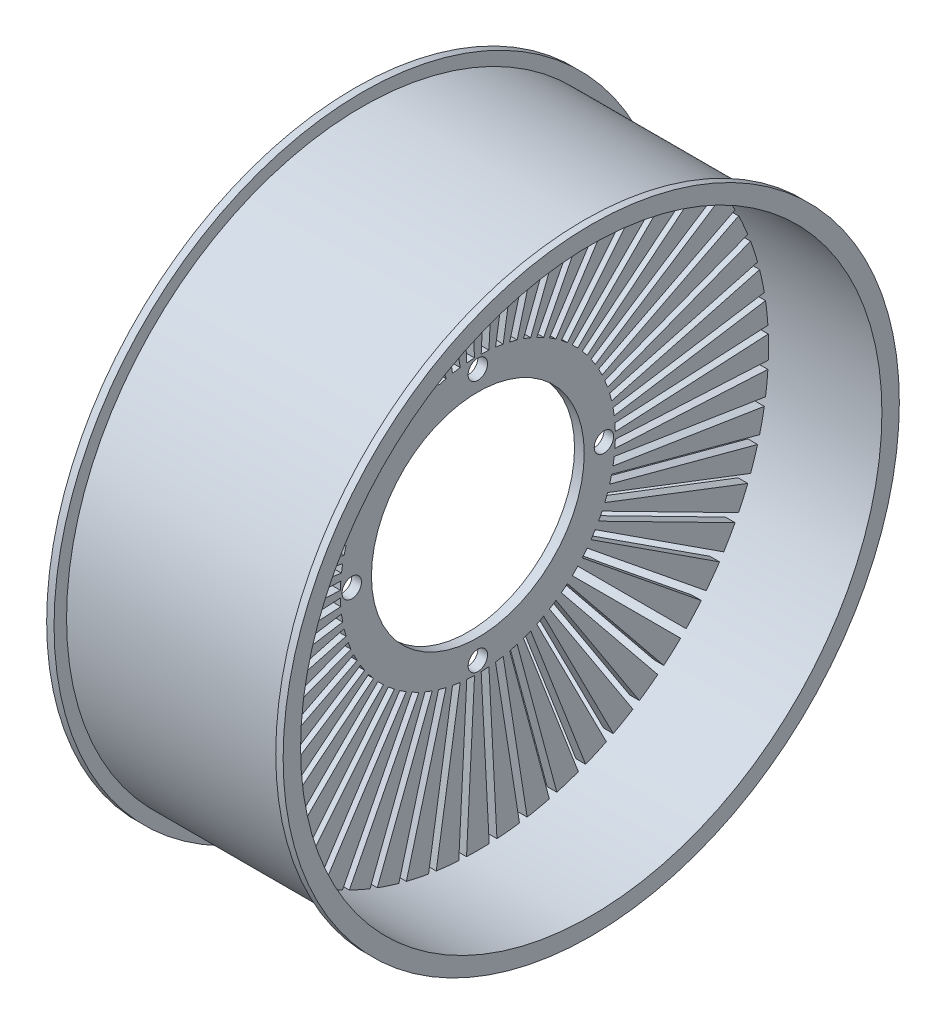
from build123d import *
from build123d.topology import SkipClean

# Parameters (mm, degrees)
SKETCH2_R          = 5
CUT_EXTRUDE1_DEPTH = 10
CUT_EXTRUDE2_DEPTH = 61


with BuildPart() as part:
    # Sketch1 → Revolve2 (revolve)
    with BuildSketch(Plane(origin=(0, 0, 0), x_dir=(1, 0, 0), z_dir=(0, 1, 0))):
        Polygon((-57.15, 152.4), (57.15, 152.4), (57.15, 158.8516), (60.96, 158.8516), (60.96, 149.86), (2.5, 149.86), (2.5, 54.86), (-2.5, 54.86), (-2.5, 149.86), (-60.96, 149.86), (-60.96, 158.8516), (-57.15, 158.8516), align=None)
    revolve(axis=Axis((-145.404610984, 0, 0), (1, 0, 0)))

    # Sketch2 → Cut-Extrude1 (cut)
    with BuildSketch(Plane.ZY.offset(2.5)):
        with Locations((-65, 0)):
            Circle(SKETCH2_R)
        with Locations((0, 65)):
            Circle(SKETCH2_R)
        with Locations((65, 0)):
            Circle(SKETCH2_R)
        with Locations((0, -65)):
            Circle(SKETCH2_R)
    extrude(amount=-CUT_EXTRUDE1_DEPTH, mode=Mode.SUBTRACT)

    # Sketch3 → Cut-Extrude2 (cut)
    with SkipClean():  # the faces are left unmerged after this step: merging them gives an invalid solid
        with BuildSketch(Plane.ZY.offset(2.5)):
            with BuildLine():
                Line((-48.698690151, -51.527117276), (-104.543371348, -107.371798472))
                ThreePointArc((-104.543371348, -107.371798472), (-105.967022229, -105.967022229), (-107.371798473, -104.543371348))
                Line((-107.371798473, -104.543371348), (-51.527117276, -48.698690151))
                Line((-51.527117276, -48.698690151), (-48.698690151, -51.527117276))
            make_face()
            with BuildLine():
                Line((-53.817964016, -46.154447091), (-56.33524558, -43.045863245))
                Line((-56.33524558, -43.045863245), (-117.711362478, -92.747262728))
                ThreePointArc((-117.711362478, -92.747262728), (-116.463093784, -94.309953803), (-115.194080914, -95.855846574))
                Line((-115.194080914, -95.855846574), (-53.817964016, -46.154447091))
            make_face()
            with BuildLine():
                Line((-58.347597006, -40.276099126), (-60.526153146, -36.921416854))
                Line((-60.526153146, -36.921416854), (-126.761256163, -79.93499569))
                ThreePointArc((-126.761256163, -79.93499569), (-125.683171312, -81.619605787), (-124.582700023, -83.289677962))
                Line((-124.582700023, -83.289677962), (-58.347597006, -40.276099126))
            make_face()
            with BuildLine():
                Line((-62.237961512, -33.95647779), (-64.053923511, -30.392451694))
                Line((-64.053923511, -30.392451694), (-134.422326999, -66.246944111))
                ThreePointArc((-134.422326999, -66.246944111), (-133.526237715, -68.035016291), (-132.606365001, -69.810970208))
                Line((-132.606365001, -69.810970208), (-62.237961512, -33.95647779))
            make_face()
            with BuildLine():
                Line((-65.446433889, -27.264822178), (-66.879905687, -23.530500472))
                Line((-66.879905687, -23.530500472), (-140.610638691, -51.83307715))
                ThreePointArc((-140.610638691, -51.83307715), (-139.906362715, -53.705020919), (-139.177166893, -55.567398856))
                Line((-139.177166893, -55.567398856), (-65.446433889, -27.264822178))
            make_face()
            with BuildLine():
                Line((-67.93786144, -20.274447469), (-68.97313762, -16.410744164))
                Line((-68.97313762, -16.410744164), (-145.258390801, -36.851316148))
                ThreePointArc((-145.258390801, -36.851316148), (-144.753644328, -38.786622099), (-144.223114621, -40.715019453))
                Line((-144.223114621, -40.715019453), (-67.93786144, -20.274447469))
            make_face()
            with BuildLine():
                Line((-69.684947564, -13.06194167), (-70.310685424, -9.111188308))
                Line((-70.310685424, -9.111188308), (-148.314661584, -21.465804415))
                ThreePointArc((-148.314661584, -21.465804415), (-148.014974722, -23.443268931), (-147.688923724, -25.416557778))
                Line((-147.688923724, -25.416557778), (-69.684947564, -13.06194167))
            make_face()
            with BuildLine():
                Line((-70.66855082, -5.706326505), (-70.877894645, -1.711808367))
                Line((-70.877894645, -1.711808367), (-149.745965898, -5.845108837))
                ThreePointArc((-149.745965898, -5.845108837), (-149.654622078, -7.843066402), (-149.536622073, -9.839626976))
                Line((-149.536622073, -9.839626976), (-70.66855082, -5.706326505))
            make_face()
            with BuildLine():
                Line((-70.877894645, 1.711808367), (-70.66855082, 5.706326506))
                Line((-70.66855082, 5.706326506), (-149.536622073, 9.839626976))
                ThreePointArc((-149.536622073, 9.839626976), (-149.654622078, 7.843066403), (-149.745965898, 5.845108837))
                Line((-149.745965898, 5.845108837), (-70.877894645, 1.711808367))
            make_face()
            with BuildLine():
                Line((-70.310685424, 9.111188308), (-69.684947564, 13.06194167))
                Line((-69.684947564, 13.06194167), (-147.688923724, 25.416557778))
                ThreePointArc((-147.688923724, 25.416557778), (-148.014974722, 23.443268931), (-148.314661584, 21.465804416))
                Line((-148.314661584, 21.465804416), (-70.310685424, 9.111188308))
            make_face()
            with BuildLine():
                Line((-68.97313762, 16.410744164), (-67.93786144, 20.274447469))
                Line((-67.93786144, 20.274447469), (-144.223114621, 40.715019453))
                ThreePointArc((-144.223114621, 40.715019453), (-144.753644328, 38.786622099), (-145.258390801, 36.851316148))
                Line((-145.258390801, 36.851316148), (-68.97313762, 16.410744164))
            make_face()
            with BuildLine():
                Line((-66.879905687, 23.530500473), (-65.446433889, 27.264822178))
                Line((-65.446433889, 27.264822178), (-139.177166893, 55.567398856))
                ThreePointArc((-139.177166893, 55.567398856), (-139.906362715, 53.705020919), (-140.610638691, 51.83307715))
                Line((-140.610638691, 51.83307715), (-66.879905687, 23.530500473))
            make_face()
            with BuildLine():
                Line((-64.053923511, 30.392451694), (-62.237961512, 33.95647779))
                Line((-62.237961512, 33.95647779), (-132.606365, 69.810970208))
                ThreePointArc((-132.606365, 69.810970208), (-133.526237715, 68.035016291), (-134.422326999, 66.246944111))
                Line((-134.422326999, 66.246944111), (-64.053923511, 30.392451694))
            make_face()
            with BuildLine():
                Line((-60.526153146, 36.921416854), (-58.347597006, 40.276099126))
                Line((-58.347597006, 40.276099126), (-124.582700023, 83.289677962))
                ThreePointArc((-124.582700023, 83.289677962), (-125.683171312, 81.619605787), (-126.761256163, 79.93499569))
                Line((-126.761256163, 79.93499569), (-60.526153146, 36.921416854))
            make_face()
            with BuildLine():
                Line((-56.33524558, 43.045863246), (-53.817964016, 46.154447091))
                Line((-53.817964016, 46.154447091), (-115.194080914, 95.855846574))
                ThreePointArc((-115.194080914, 95.855846574), (-116.463093784, 94.309953803), (-117.711362478, 92.747262729))
                Line((-117.711362478, 92.747262729), (-56.33524558, 43.045863246))
            make_face()
            with BuildLine():
                Line((-51.527117276, 48.698690151), (-48.698690151, 51.527117276))
                Line((-48.698690151, 51.527117276), (-104.543371348, 107.371798473))
                ThreePointArc((-104.543371348, 107.371798473), (-105.967022229, 105.967022229), (-107.371798472, 104.543371348))
                Line((-107.371798472, 104.543371348), (-51.527117276, 48.698690151))
            make_face()
            with BuildLine():
                Line((-46.154447091, 53.817964016), (-43.045863245, 56.33524558))
                Line((-43.045863245, 56.33524558), (-92.747262728, 117.711362478))
                ThreePointArc((-92.747262728, 117.711362478), (-94.309953803, 116.463093784), (-95.855846574, 115.194080914))
                Line((-95.855846574, 115.194080914), (-46.154447091, 53.817964016))
            make_face()
            with BuildLine():
                Line((-40.276099126, 58.347597006), (-36.921416854, 60.526153146))
                Line((-36.921416854, 60.526153146), (-79.93499569, 126.761256163))
                ThreePointArc((-79.93499569, 126.761256163), (-81.619605787, 125.683171312), (-83.289677962, 124.582700023))
                Line((-83.289677962, 124.582700023), (-40.276099126, 58.347597006))
            make_face()
            with BuildLine():
                Line((-33.95647779, 62.237961512), (-30.392451694, 64.053923511))
                Line((-30.392451694, 64.053923511), (-66.246944111, 134.422326999))
                ThreePointArc((-66.246944111, 134.422326999), (-68.035016291, 133.526237715), (-69.810970208, 132.606365001))
                Line((-69.810970208, 132.606365001), (-33.95647779, 62.237961512))
            make_face()
            with BuildLine():
                Line((-27.264822178, 65.446433889), (-23.530500472, 66.879905687))
                Line((-23.530500472, 66.879905687), (-51.83307715, 140.610638691))
                ThreePointArc((-51.83307715, 140.610638691), (-53.705020919, 139.906362715), (-55.567398856, 139.177166893))
                Line((-55.567398856, 139.177166893), (-27.264822178, 65.446433889))
            make_face()
            with BuildLine():
                Line((-20.274447469, 67.93786144), (-16.410744164, 68.97313762))
                Line((-16.410744164, 68.97313762), (-36.851316148, 145.258390801))
                ThreePointArc((-36.851316148, 145.258390801), (-38.786622099, 144.753644328), (-40.715019453, 144.223114621))
                Line((-40.715019453, 144.223114621), (-20.274447469, 67.93786144))
            make_face()
            with BuildLine():
                Line((-13.06194167, 69.684947564), (-9.111188308, 70.310685424))
                Line((-9.111188308, 70.310685424), (-21.465804415, 148.314661584))
                ThreePointArc((-21.465804415, 148.314661584), (-23.443268931, 148.014974722), (-25.416557778, 147.688923724))
                Line((-25.416557778, 147.688923724), (-13.06194167, 69.684947564))
            make_face()
            with BuildLine():
                Line((-5.706326505, 70.66855082), (-1.711808367, 70.877894645))
                Line((-1.711808367, 70.877894645), (-5.845108837, 149.745965898))
                ThreePointArc((-5.845108837, 149.745965898), (-7.843066402, 149.654622078), (-9.839626976, 149.536622073))
                Line((-9.839626976, 149.536622073), (-5.706326505, 70.66855082))
            make_face()
            with BuildLine():
                Line((1.711808367, 70.877894645), (5.706326506, 70.66855082))
                Line((5.706326506, 70.66855082), (9.839626976, 149.536622073))
                ThreePointArc((9.839626976, 149.536622073), (7.843066403, 149.654622078), (5.845108837, 149.745965898))
                Line((5.845108837, 149.745965898), (1.711808367, 70.877894645))
            make_face()
            with BuildLine():
                Line((9.111188308, 70.310685424), (13.06194167, 69.684947564))
                Line((13.06194167, 69.684947564), (25.416557778, 147.688923724))
                ThreePointArc((25.416557778, 147.688923724), (23.443268931, 148.014974722), (21.465804416, 148.314661584))
                Line((21.465804416, 148.314661584), (9.111188308, 70.310685424))
            make_face()
            with BuildLine():
                Line((16.410744164, 68.97313762), (20.274447469, 67.93786144))
                Line((20.274447469, 67.93786144), (40.715019453, 144.223114621))
                ThreePointArc((40.715019453, 144.223114621), (38.786622099, 144.753644328), (36.851316148, 145.258390801))
                Line((36.851316148, 145.258390801), (16.410744164, 68.97313762))
            make_face()
            with BuildLine():
                Line((23.530500473, 66.879905687), (27.264822178, 65.446433889))
                Line((27.264822178, 65.446433889), (55.567398856, 139.177166893))
                ThreePointArc((55.567398856, 139.177166893), (53.705020919, 139.906362715), (51.83307715, 140.610638691))
                Line((51.83307715, 140.610638691), (23.530500473, 66.879905687))
            make_face()
            with BuildLine():
                Line((30.392451694, 64.053923511), (33.95647779, 62.237961512))
                Line((33.95647779, 62.237961512), (69.810970208, 132.606365))
                ThreePointArc((69.810970208, 132.606365), (68.035016291, 133.526237715), (66.246944111, 134.422326999))
                Line((66.246944111, 134.422326999), (30.392451694, 64.053923511))
            make_face()
            with BuildLine():
                Line((36.921416854, 60.526153146), (40.276099126, 58.347597006))
                Line((40.276099126, 58.347597006), (83.289677962, 124.582700023))
                ThreePointArc((83.289677962, 124.582700023), (81.619605787, 125.683171312), (79.93499569, 126.761256163))
                Line((79.93499569, 126.761256163), (36.921416854, 60.526153146))
            make_face()
            with BuildLine():
                Line((43.045863246, 56.33524558), (46.154447091, 53.817964016))
                Line((46.154447091, 53.817964016), (95.855846574, 115.194080914))
                ThreePointArc((95.855846574, 115.194080914), (94.309953803, 116.463093784), (92.747262729, 117.711362478))
                Line((92.747262729, 117.711362478), (43.045863246, 56.33524558))
            make_face()
            with BuildLine():
                Line((48.698690151, 51.527117276), (51.527117276, 48.698690151))
                Line((51.527117276, 48.698690151), (107.371798473, 104.543371348))
                ThreePointArc((107.371798473, 104.543371348), (105.967022229, 105.967022229), (104.543371348, 107.371798472))
                Line((104.543371348, 107.371798472), (48.698690151, 51.527117276))
            make_face()
            with BuildLine():
                Line((53.817964016, 46.154447091), (56.33524558, 43.045863245))
                Line((56.33524558, 43.045863245), (117.711362478, 92.747262728))
                ThreePointArc((117.711362478, 92.747262728), (116.463093784, 94.309953803), (115.194080914, 95.855846574))
                Line((115.194080914, 95.855846574), (53.817964016, 46.154447091))
            make_face()
            with BuildLine():
                Line((58.347597006, 40.276099126), (60.526153146, 36.921416854))
                Line((60.526153146, 36.921416854), (126.761256163, 79.93499569))
                ThreePointArc((126.761256163, 79.93499569), (125.683171312, 81.619605787), (124.582700023, 83.289677962))
                Line((124.582700023, 83.289677962), (58.347597006, 40.276099126))
            make_face()
            with BuildLine():
                Line((62.237961512, 33.95647779), (64.053923511, 30.392451694))
                Line((64.053923511, 30.392451694), (134.422326999, 66.246944111))
                ThreePointArc((134.422326999, 66.246944111), (133.526237715, 68.035016291), (132.606365001, 69.810970208))
                Line((132.606365001, 69.810970208), (62.237961512, 33.95647779))
            make_face()
            with BuildLine():
                Line((65.446433889, 27.264822178), (66.879905687, 23.530500472))
                Line((66.879905687, 23.530500472), (140.610638691, 51.83307715))
                ThreePointArc((140.610638691, 51.83307715), (139.906362715, 53.705020919), (139.177166893, 55.567398856))
                Line((139.177166893, 55.567398856), (65.446433889, 27.264822178))
            make_face()
            with BuildLine():
                Line((67.93786144, 20.274447469), (68.97313762, 16.410744164))
                Line((68.97313762, 16.410744164), (145.258390801, 36.851316148))
                ThreePointArc((145.258390801, 36.851316148), (144.753644328, 38.786622099), (144.223114621, 40.715019453))
                Line((144.223114621, 40.715019453), (67.93786144, 20.274447469))
            make_face()
            with BuildLine():
                Line((69.684947564, 13.06194167), (70.310685424, 9.111188308))
                Line((70.310685424, 9.111188308), (148.314661584, 21.465804415))
                ThreePointArc((148.314661584, 21.465804415), (148.014974722, 23.443268931), (147.688923724, 25.416557778))
                Line((147.688923724, 25.416557778), (69.684947564, 13.06194167))
            make_face()
            with BuildLine():
                Line((70.66855082, 5.706326505), (70.877894645, 1.711808367))
                Line((70.877894645, 1.711808367), (149.745965898, 5.845108837))
                ThreePointArc((149.745965898, 5.845108837), (149.654622078, 7.843066402), (149.536622073, 9.839626976))
                Line((149.536622073, 9.839626976), (70.66855082, 5.706326505))
            make_face()
            with BuildLine():
                Line((70.877894645, -1.711808367), (70.66855082, -5.706326506))
                Line((70.66855082, -5.706326506), (149.536622073, -9.839626976))
                ThreePointArc((149.536622073, -9.839626976), (149.654622078, -7.843066403), (149.745965898, -5.845108837))
                Line((149.745965898, -5.845108837), (70.877894645, -1.711808367))
            make_face()
            with BuildLine():
                Line((70.310685424, -9.111188308), (69.684947564, -13.06194167))
                Line((69.684947564, -13.06194167), (147.688923724, -25.416557778))
                ThreePointArc((147.688923724, -25.416557778), (148.014974722, -23.443268931), (148.314661584, -21.465804416))
                Line((148.314661584, -21.465804416), (70.310685424, -9.111188308))
            make_face()
            with BuildLine():
                Line((68.97313762, -16.410744164), (67.93786144, -20.274447469))
                Line((67.93786144, -20.274447469), (144.223114621, -40.715019453))
                ThreePointArc((144.223114621, -40.715019453), (144.753644328, -38.786622099), (145.258390801, -36.851316148))
                Line((145.258390801, -36.851316148), (68.97313762, -16.410744164))
            make_face()
            with BuildLine():
                Line((66.879905687, -23.530500473), (65.446433889, -27.264822178))
                Line((65.446433889, -27.264822178), (139.177166893, -55.567398856))
                ThreePointArc((139.177166893, -55.567398856), (139.906362715, -53.705020919), (140.610638691, -51.83307715))
                Line((140.610638691, -51.83307715), (66.879905687, -23.530500473))
            make_face()
            with BuildLine():
                Line((64.053923511, -30.392451694), (62.237961512, -33.95647779))
                Line((62.237961512, -33.95647779), (132.606365, -69.810970208))
                ThreePointArc((132.606365, -69.810970208), (133.526237715, -68.035016291), (134.422326999, -66.246944111))
                Line((134.422326999, -66.246944111), (64.053923511, -30.392451694))
            make_face()
            with BuildLine():
                Line((60.526153146, -36.921416854), (58.347597006, -40.276099126))
                Line((58.347597006, -40.276099126), (124.582700023, -83.289677962))
                ThreePointArc((124.582700023, -83.289677962), (125.683171312, -81.619605787), (126.761256163, -79.93499569))
                Line((126.761256163, -79.93499569), (60.526153146, -36.921416854))
            make_face()
            with BuildLine():
                Line((56.33524558, -43.045863246), (53.817964016, -46.154447091))
                Line((53.817964016, -46.154447091), (115.194080914, -95.855846574))
                ThreePointArc((115.194080914, -95.855846574), (116.463093784, -94.309953803), (117.711362478, -92.747262729))
                Line((117.711362478, -92.747262729), (56.33524558, -43.045863246))
            make_face()
            with BuildLine():
                Line((51.527117276, -48.698690151), (48.698690151, -51.527117276))
                Line((48.698690151, -51.527117276), (104.543371348, -107.371798473))
                ThreePointArc((104.543371348, -107.371798473), (105.967022229, -105.967022229), (107.371798472, -104.543371348))
                Line((107.371798472, -104.543371348), (51.527117276, -48.698690151))
            make_face()
            with BuildLine():
                Line((46.154447091, -53.817964016), (43.045863245, -56.33524558))
                Line((43.045863245, -56.33524558), (92.747262728, -117.711362478))
                ThreePointArc((92.747262728, -117.711362478), (94.309953803, -116.463093784), (95.855846574, -115.194080914))
                Line((95.855846574, -115.194080914), (46.154447091, -53.817964016))
            make_face()
            with BuildLine():
                Line((40.276099126, -58.347597006), (36.921416854, -60.526153146))
                Line((36.921416854, -60.526153146), (79.93499569, -126.761256163))
                ThreePointArc((79.93499569, -126.761256163), (81.619605787, -125.683171312), (83.289677962, -124.582700023))
                Line((83.289677962, -124.582700023), (40.276099126, -58.347597006))
            make_face()
            with BuildLine():
                Line((33.95647779, -62.237961512), (30.392451694, -64.053923511))
                Line((30.392451694, -64.053923511), (66.246944111, -134.422326999))
                ThreePointArc((66.246944111, -134.422326999), (68.035016291, -133.526237715), (69.810970208, -132.606365001))
                Line((69.810970208, -132.606365001), (33.95647779, -62.237961512))
            make_face()
            with BuildLine():
                Line((27.264822178, -65.446433889), (23.530500472, -66.879905687))
                Line((23.530500472, -66.879905687), (51.83307715, -140.610638691))
                ThreePointArc((51.83307715, -140.610638691), (53.705020919, -139.906362715), (55.567398856, -139.177166893))
                Line((55.567398856, -139.177166893), (27.264822178, -65.446433889))
            make_face()
            with BuildLine():
                Line((20.274447469, -67.93786144), (16.410744164, -68.97313762))
                Line((16.410744164, -68.97313762), (36.851316148, -145.258390801))
                ThreePointArc((36.851316148, -145.258390801), (38.786622099, -144.753644328), (40.715019453, -144.223114621))
                Line((40.715019453, -144.223114621), (20.274447469, -67.93786144))
            make_face()
            with BuildLine():
                Line((13.06194167, -69.684947564), (9.111188308, -70.310685424))
                Line((9.111188308, -70.310685424), (21.465804415, -148.314661584))
                ThreePointArc((21.465804415, -148.314661584), (23.443268931, -148.014974722), (25.416557778, -147.688923724))
                Line((25.416557778, -147.688923724), (13.06194167, -69.684947564))
            make_face()
            with BuildLine():
                Line((5.706326505, -70.66855082), (1.711808367, -70.877894645))
                Line((1.711808367, -70.877894645), (5.845108837, -149.745965898))
                ThreePointArc((5.845108837, -149.745965898), (7.843066402, -149.654622078), (9.839626976, -149.536622073))
                Line((9.839626976, -149.536622073), (5.706326505, -70.66855082))
            make_face()
            with BuildLine():
                Line((-1.711808367, -70.877894645), (-5.706326506, -70.66855082))
                Line((-5.706326506, -70.66855082), (-9.839626976, -149.536622073))
                ThreePointArc((-9.839626976, -149.536622073), (-7.843066403, -149.654622078), (-5.845108837, -149.745965898))
                Line((-5.845108837, -149.745965898), (-1.711808367, -70.877894645))
            make_face()
            with BuildLine():
                Line((-9.111188308, -70.310685424), (-13.06194167, -69.684947564))
                Line((-13.06194167, -69.684947564), (-25.416557778, -147.688923724))
                ThreePointArc((-25.416557778, -147.688923724), (-23.443268931, -148.014974722), (-21.465804416, -148.314661584))
                Line((-21.465804416, -148.314661584), (-9.111188308, -70.310685424))
            make_face()
            with BuildLine():
                Line((-16.410744164, -68.97313762), (-20.274447469, -67.93786144))
                Line((-20.274447469, -67.93786144), (-40.715019453, -144.223114621))
                ThreePointArc((-40.715019453, -144.223114621), (-38.786622099, -144.753644328), (-36.851316148, -145.258390801))
                Line((-36.851316148, -145.258390801), (-16.410744164, -68.97313762))
            make_face()
            with BuildLine():
                Line((-23.530500473, -66.879905687), (-27.264822178, -65.446433889))
                Line((-27.264822178, -65.446433889), (-55.567398856, -139.177166893))
                ThreePointArc((-55.567398856, -139.177166893), (-53.705020919, -139.906362715), (-51.83307715, -140.610638691))
                Line((-51.83307715, -140.610638691), (-23.530500473, -66.879905687))
            make_face()
            with BuildLine():
                Line((-30.392451694, -64.053923511), (-33.95647779, -62.237961512))
                Line((-33.95647779, -62.237961512), (-69.810970208, -132.606365))
                ThreePointArc((-69.810970208, -132.606365), (-68.035016291, -133.526237715), (-66.246944111, -134.422326999))
                Line((-66.246944111, -134.422326999), (-30.392451694, -64.053923511))
            make_face()
            with BuildLine():
                Line((-36.921416854, -60.526153146), (-40.276099126, -58.347597006))
                Line((-40.276099126, -58.347597006), (-83.289677962, -124.582700023))
                ThreePointArc((-83.289677962, -124.582700023), (-81.619605787, -125.683171312), (-79.93499569, -126.761256163))
                Line((-79.93499569, -126.761256163), (-36.921416854, -60.526153146))
            make_face()
            with BuildLine():
                Line((-43.045863246, -56.33524558), (-46.154447091, -53.817964016))
                Line((-46.154447091, -53.817964016), (-95.855846574, -115.194080914))
                ThreePointArc((-95.855846574, -115.194080914), (-94.309953803, -116.463093784), (-92.747262729, -117.711362478))
                Line((-92.747262729, -117.711362478), (-43.045863246, -56.33524558))
            make_face()
        extrude(amount=-CUT_EXTRUDE2_DEPTH, mode=Mode.SUBTRACT)


solid = part.part
